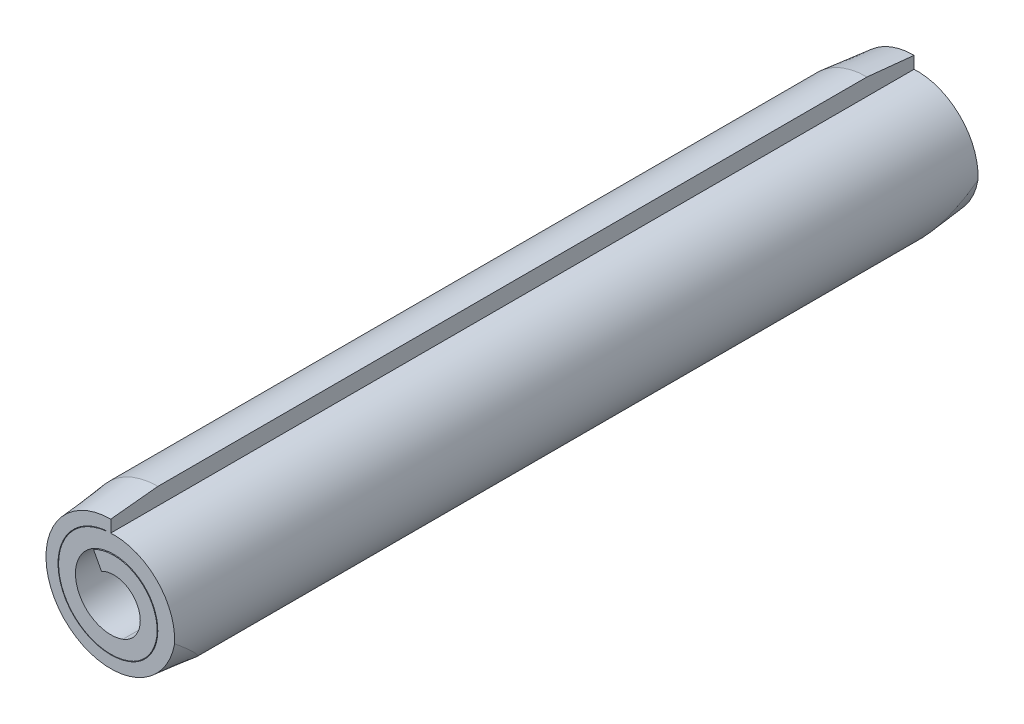
from build123d import *

# Parameters (mm, degrees)
EXTRUDE_THIN1_DEPTH = 9.525


with BuildPart() as part:
    # Sketch2 → Extrude-Thin1 (new, symmetric)
    with BuildSketch(Plane.XY):
        with BuildLine():
            ThreePointArc((0, 1.651), (-1.6259176, -0.286693141), (0.564675257, -1.551432517))
            ThreePointArc((0.564675257, -1.551432517), (1.428087859, 0.300161785), (-0.423506442, 1.163574388))
            ThreePointArc((-0.423506442, 1.163574388), (-1.163574388, -0.423506442), (0.423506442, -1.163574388))
            ThreePointArc((0.423506442, -1.163574388), (1.010514268, 0.218497398), (-0.408926516, 0.708281502))
            Line((-0.408926516, 0.708281502), (-0.22127156, 0.354615342))
            ThreePointArc((-0.22127156, 0.354615342), (0.644689881, 0.055811649), (0.286572693, -0.787352002))
            ThreePointArc((0.286572693, -0.787352002), (-0.787352002, -0.286572693), (-0.286572693, 0.787352002))
            ThreePointArc((-0.286572693, 0.787352002), (1.051865474, 0.163228035), (0.427741507, -1.175210132))
            ThreePointArc((0.427741507, -1.175210132), (-1.231632582, -0.217170055), (0, 1.2506325))
            Line((0, 1.2506325), (0, 1.651))
        make_face()
    extrude(amount=EXTRUDE_THIN1_DEPTH, both=True)

    # Sketch3 → Cut-Revolve1 (revolve, cut)
    with BuildSketch(Plane(origin=(0, 0, 0), x_dir=(0, 0, -1), z_dir=(1, 0, 0))):
        Polygon((-9.525, 1.651), (-9.525, 1.5367), (-8.4074, 1.651), align=None)
        Polygon((8.4074, 1.651), (9.525, 1.651), (9.525, 1.5367), align=None)
    revolve(axis=Axis((0, 0, 0), (0, 0, 1)), mode=Mode.SUBTRACT)


solid = part.part
